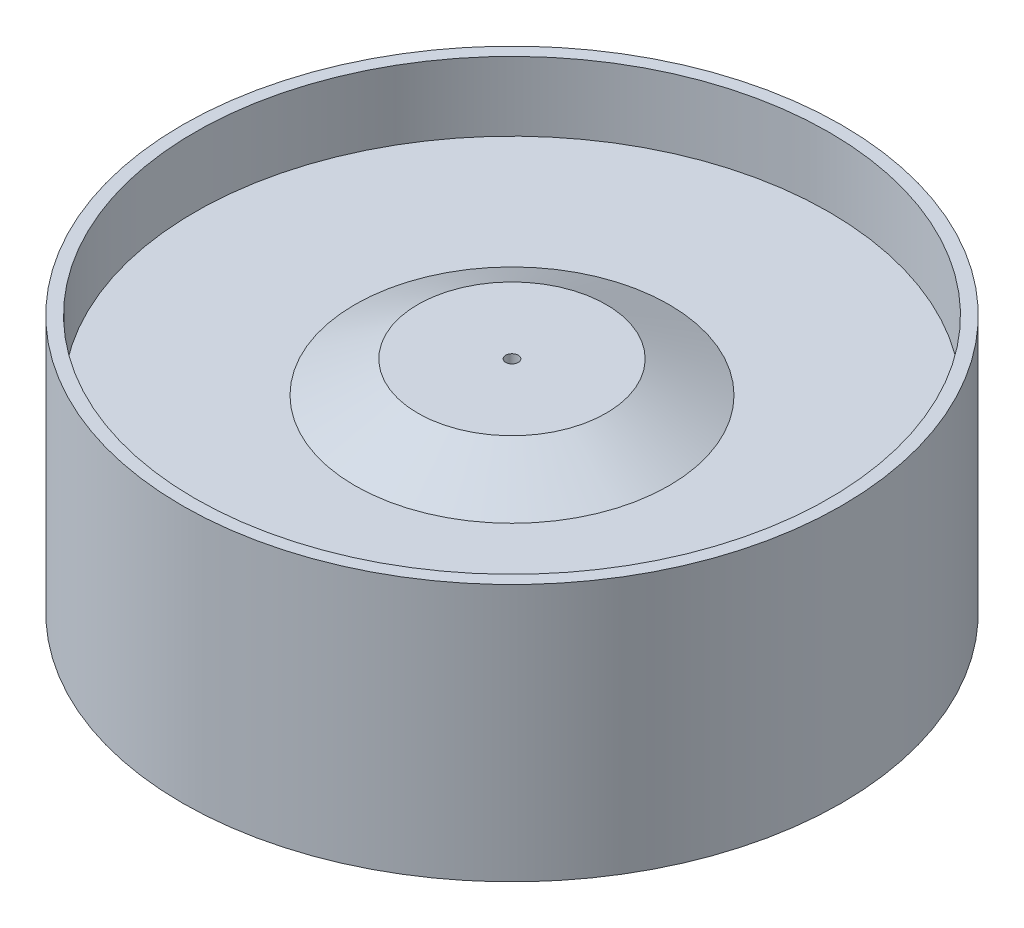
from build123d import *

# Parameters (mm, degrees)
SKETCH1_R                          = 52.5
SKETCH1_R_2                        = 50.5
MAIN_BLADE_CASE_EXTRUDE_DEPTH      = 41
SKETCH2_R                          = 50.5
EXTRUDE_FOR_GOBLET_TO_SIT_ON_DEPTH = 9
SKETCH5_R                          = 15
SKETCH4_R                          = 25
SKETCH8_R                          = 33
SKETCH8_R_2                        = 32
MAIN_LOWER_EXTRUDE_DEPTH           = 10
SKETCH9_R                          = 32
SKETCH9_R_2                        = 25
SECOND_LOWER_EXTRUDE_DEPTH         = 6
SKETCH12_R                         = 25
THIRD_LOWER_EXTRUDE_DEPTH          = 5
SKETCH13_R                         = 1
HOLE_FOR_SCREW_BLADE_CASING_DEPTH  = 89


with BuildPart() as part:
    # Sketch1 → Main Blade Case Extrude (new body)
    with BuildSketch(Plane(origin=(0, 0, 0), x_dir=(1, 0, 0), z_dir=(0, 1, 0))):
        with Locations(Location((0, 0, 0), (0, 0, 270))):
            Circle(SKETCH1_R)
        with Locations(Location((0, 0, 0), (0, 0, 270))):
            Circle(SKETCH1_R_2, mode=Mode.SUBTRACT)
    extrude(amount=MAIN_BLADE_CASE_EXTRUDE_DEPTH)

    # Sketch2 → Extrude for Goblet to Sit On (add)
    with BuildSketch(Plane(origin=(0, 21, 0), x_dir=(-1, 0, 0), z_dir=(0, -1, 0))):
        with Locations(Location((0, 0, 0), (0, 0, 90))):
            Circle(SKETCH2_R)
    extrude(amount=-EXTRUDE_FOR_GOBLET_TO_SIT_ON_DEPTH)

    # Sketch5 → Rounded Middle Section section 0
    with BuildSketch(Plane(origin=(0, 35, 0), x_dir=(1, 0, 0), z_dir=(0, 1, 0))):
        Circle(SKETCH5_R)
    # Sketch4 → Rounded Middle Section section 1
    with BuildSketch(Plane(origin=(0, 30, 0), x_dir=(1, 0, 0), z_dir=(0, 1, 0))):
        Circle(SKETCH4_R)
    loft()

    # Sketch8 → Main Lower Extrude (add)
    with BuildSketch(Plane.XZ.offset(-21)):
        with Locations(Location((0, 0, 0), (0, 0, 270))):
            Circle(SKETCH8_R)
        with Locations(Location((0, 0, 0), (0, 0, 270))):
            Circle(SKETCH8_R_2, mode=Mode.SUBTRACT)
    extrude(amount=MAIN_LOWER_EXTRUDE_DEPTH)

    # Sketch9 → Second Lower Extrude (add)
    with BuildSketch(Plane.XZ.offset(-21)):
        with Locations(Location((0, 0, 0), (0, 0, 270))):
            Circle(SKETCH9_R)
        with Locations(Location((0, 0, 0), (0, 0, 270))):
            Circle(SKETCH9_R_2, mode=Mode.SUBTRACT)
    extrude(amount=SECOND_LOWER_EXTRUDE_DEPTH)

    # Sketch12 → Third Lower Extrude (add)
    with BuildSketch(Plane(origin=(0, 21, 0), x_dir=(-1, 0, 0), z_dir=(0, -1, 0))):
        with Locations(Location((0, 0, 0), (0, 0, 90))):
            Circle(SKETCH12_R)
    extrude(amount=THIRD_LOWER_EXTRUDE_DEPTH)

    # Sketch13 → Hole for Screw (Blade Casing) (cut)
    with BuildSketch(Plane.XZ.offset(-16)):
        with Locations(Location((0, 0, 0), (0, 0, 270))):
            Circle(SKETCH13_R)
    extrude(amount=-HOLE_FOR_SCREW_BLADE_CASING_DEPTH, mode=Mode.SUBTRACT)


solid = part.part
